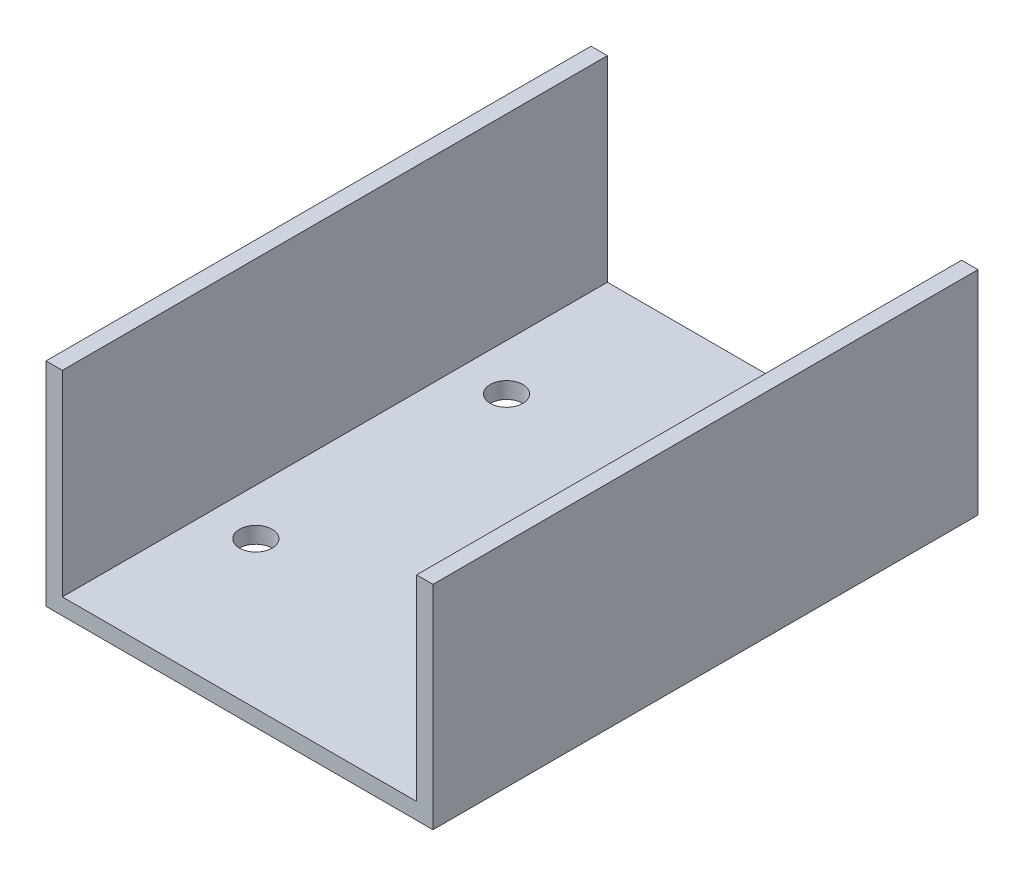
from build123d import *

# Parameters (mm, degrees)
EXTRU_MINCE1_DEPTH      = 25
ESQUISSE2_R             = 1.5
ENL_V_MAT_EXTRU_1_DEPTH = 3


with BuildPart() as part:
    # Esquisse1 → Extru.-Mince1 (new, symmetric)
    with BuildSketch(Plane.XY):
        Polygon((-17.75, 19.5), (-17.75, 0), (17.75, 0), (17.75, 19.5), (16.25, 19.5), (16.25, 1.5), (-16.25, 1.5), (-16.25, 19.5), align=None)
    extrude(amount=EXTRU_MINCE1_DEPTH, both=True)

    # Esquisse2 → Enlèv. mat.-Extru.1 (cut)
    with BuildSketch(Plane.XZ):
        with Locations(Location((-12, 11.5, 0), (0, 0, 270))):
            Circle(ESQUISSE2_R)
        with Locations(Location((-12, -11.5, 0), (0, 0, 90))):
            Circle(ESQUISSE2_R)
        with Locations(Location((12, -11.5, 0), (0, 0, 270))):
            Circle(ESQUISSE2_R)
        with Locations(Location((12, 11.5, 0), (0, 0, 90))):
            Circle(ESQUISSE2_R)
    extrude(amount=-ENL_V_MAT_EXTRU_1_DEPTH, mode=Mode.SUBTRACT)


solid = part.part
